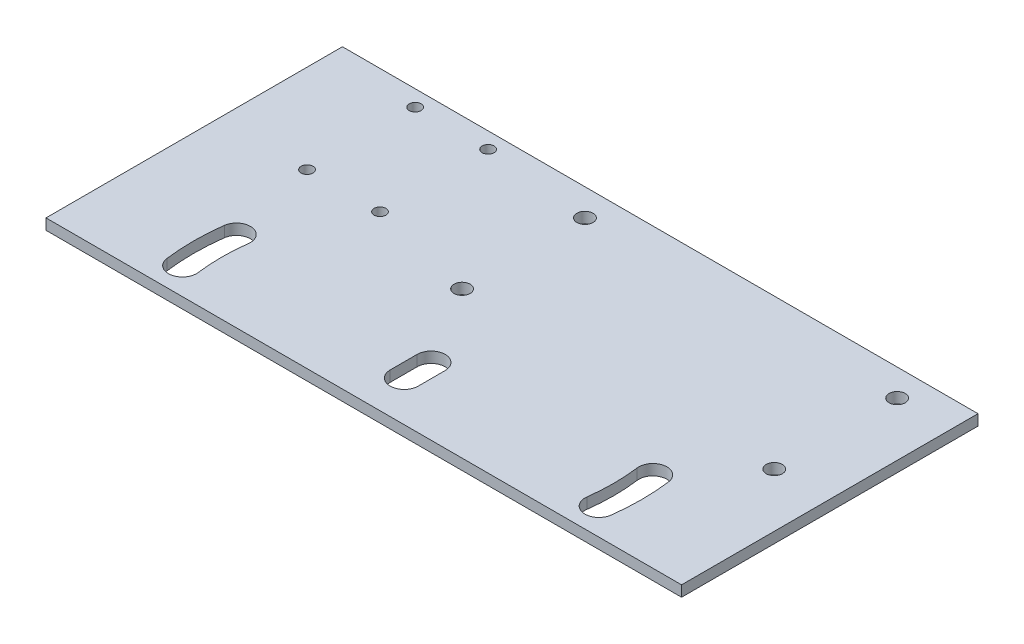
from build123d import *

# Parameters (mm, degrees)
SKETCH_1_W      = 117.92
SKETCH_1_H      = 55
SKETCH_1_R      = 1.1
SKETCH_1_R_2    = 1.5
EXTRUDE_1_DEPTH = 2


with BuildPart() as part:
    # 草图1 → 凸台-拉伸1 (new body)
    with BuildSketch(Plane(origin=(0, 0, 0), x_dir=(1, 0, 0), z_dir=(0, 1, 0))):
        with Locations((58.96, -27.5)):
            Rectangle(SKETCH_1_W, SKETCH_1_H)
        with Locations(Location((16.46, -2.97, 0), (0, 0, 270))):
            Circle(SKETCH_1_R, mode=Mode.SUBTRACT)
        with Locations(Location((30, -2.97, 0), (0, 0, 90))):
            Circle(SKETCH_1_R, mode=Mode.SUBTRACT)
        with Locations(Location((30, -23.03, 0), (0, 0, 270))):
            Circle(SKETCH_1_R, mode=Mode.SUBTRACT)
        with Locations(Location((16.46, -23.03, 0), (0, 0, 90))):
            Circle(SKETCH_1_R, mode=Mode.SUBTRACT)
        with Locations(Location((50, -5, 0), (0, 0, 270))):
            Circle(SKETCH_1_R_2, mode=Mode.SUBTRACT)
        with Locations(Location((107.92, -5, 0), (0, 0, 90))):
            Circle(SKETCH_1_R_2, mode=Mode.SUBTRACT)
        with Locations(Location((107.92, -27.8, 0), (0, 0, 270))):
            Circle(SKETCH_1_R_2, mode=Mode.SUBTRACT)
        with Locations(Location((50, -27.8, 0), (0, 0, 90))):
            Circle(SKETCH_1_R_2, mode=Mode.SUBTRACT)
        with BuildLine():
            Line((56.36, -47.5), (56.36, -42.5))
            ThreePointArc((56.36, -42.5), (58.96, -39.9), (61.56, -42.5))
            Line((61.56, -42.5), (61.56, -47.5))
            ThreePointArc((61.56, -47.5), (58.96, -50.1), (56.36, -47.5))
        make_face(mode=Mode.SUBTRACT)
        with BuildLine():
            ThreePointArc((95.019326342, -40.333675565), (95.32, -45), (95.019326342, -49.666324435))
            ThreePointArc((95.019326342, -49.666324435), (97.264150461, -52.578499683), (100.176325709, -50.333675565))
            ThreePointArc((100.176325709, -50.333675565), (100.52, -45), (100.176325709, -39.666324435))
            ThreePointArc((100.176325709, -39.666324435), (97.264150461, -37.421500317), (95.019326342, -40.333675565))
        make_face(mode=Mode.SUBTRACT)
        with BuildLine():
            ThreePointArc((22.900673658, -40.333675565), (20.655849539, -37.421500317), (17.743674291, -39.666324435))
            ThreePointArc((17.743674291, -39.666324435), (17.4, -45), (17.743674291, -50.333675565))
            ThreePointArc((17.743674291, -50.333675565), (20.655849539, -52.578499683), (22.900673658, -49.666324435))
            ThreePointArc((22.900673658, -49.666324435), (22.6, -45), (22.900673658, -40.333675565))
        make_face(mode=Mode.SUBTRACT)
    extrude(amount=EXTRUDE_1_DEPTH)


solid = part.part
